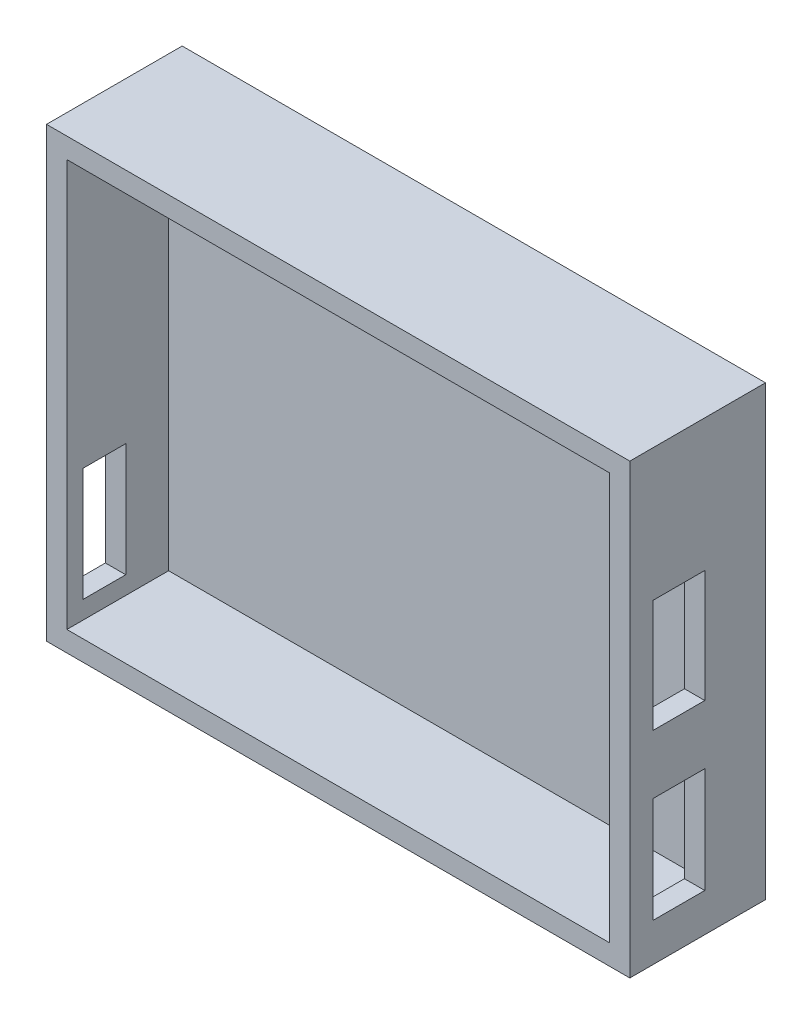
from build123d import *

# Parameters (mm, degrees)
ESQUISSE4_W             = 86
ESQUISSE4_H             = 66
BOSS_EXTRU_3_DEPTH      = 5
ESQUISSE5_W             = 86
ESQUISSE5_H             = 66
ESQUISSE5_W_2           = 80
ESQUISSE5_H_2           = 60
BOSS_EXTRU_5_DEPTH      = 15
ESQUISSE7_W             = 6.326895014
ESQUISSE7_H             = 16.739909725
ENL_V_MAT_EXTRU_3_DEPTH = 15
ESQUISSE8_W             = 7.644998142
ESQUISSE8_H             = 15.55361691
ESQUISSE8_H_2           = 16.608099413
ENL_V_MAT_EXTRU_4_DEPTH = 15


with BuildPart() as part:
    # Esquisse4 → Boss.-Extru.3 (new body)
    with BuildSketch(Plane.XY):
        with Locations((7.16988417, -5.664092664)):
            Rectangle(ESQUISSE4_W, ESQUISSE4_H)
    extrude(amount=BOSS_EXTRU_3_DEPTH)

    # Esquisse5 → Boss.-Extru.5 (add)
    with BuildSketch(Plane.XY.offset(5)):
        with Locations((7.16988417, -5.664092664)):
            Rectangle(ESQUISSE5_W, ESQUISSE5_H)
        with Locations((7.16988417, -5.664092664)):
            Rectangle(ESQUISSE5_W_2, ESQUISSE5_H_2, mode=Mode.SUBTRACT)
    extrude(amount=BOSS_EXTRU_5_DEPTH)

    # Esquisse7 → Enlèv. mat.-Extru.3 (cut)
    with BuildSketch(Plane.ZY.offset(35.83011583)):
        with Locations((14.481550635, -24.644777708)):
            Rectangle(ESQUISSE7_W, ESQUISSE7_H)
    extrude(amount=-ENL_V_MAT_EXTRU_3_DEPTH, mode=Mode.SUBTRACT)

    # Esquisse8 → Enlèv. mat.-Extru.4 (cut)
    with BuildSketch(Plane(origin=(50.16988417, 0, 0), x_dir=(0, 0, -1), z_dir=(1, 0, 0))):
        with Locations((-12.768016569, -25.237924115)):
            Rectangle(ESQUISSE8_W, ESQUISSE8_H)
        with Locations((-12.768016569, -0.457585309)):
            Rectangle(ESQUISSE8_W, ESQUISSE8_H_2)
    extrude(amount=-ENL_V_MAT_EXTRU_4_DEPTH, mode=Mode.SUBTRACT)


solid = part.part
